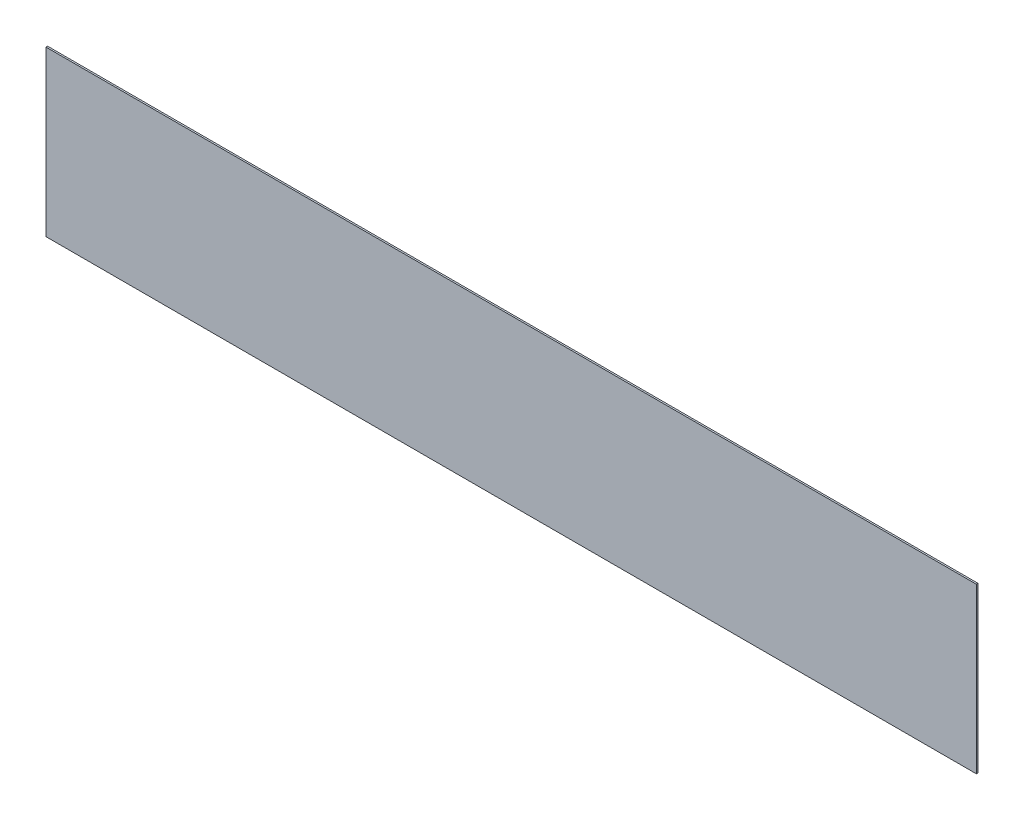
from build123d import *

# Parameters (mm, degrees)
CROQUIS1_W              = 3400
CROQUIS1_H              = 600
SALIENTE_EXTRUIR1_DEPTH = 6


with BuildPart() as part:
    # Croquis1 → Saliente-Extruir1 (new body)
    with BuildSketch(Plane.XY):
        with Locations((1135.390954763, 82.107159086)):
            Rectangle(CROQUIS1_W, CROQUIS1_H)
    extrude(amount=SALIENTE_EXTRUIR1_DEPTH)


solid = part.part
